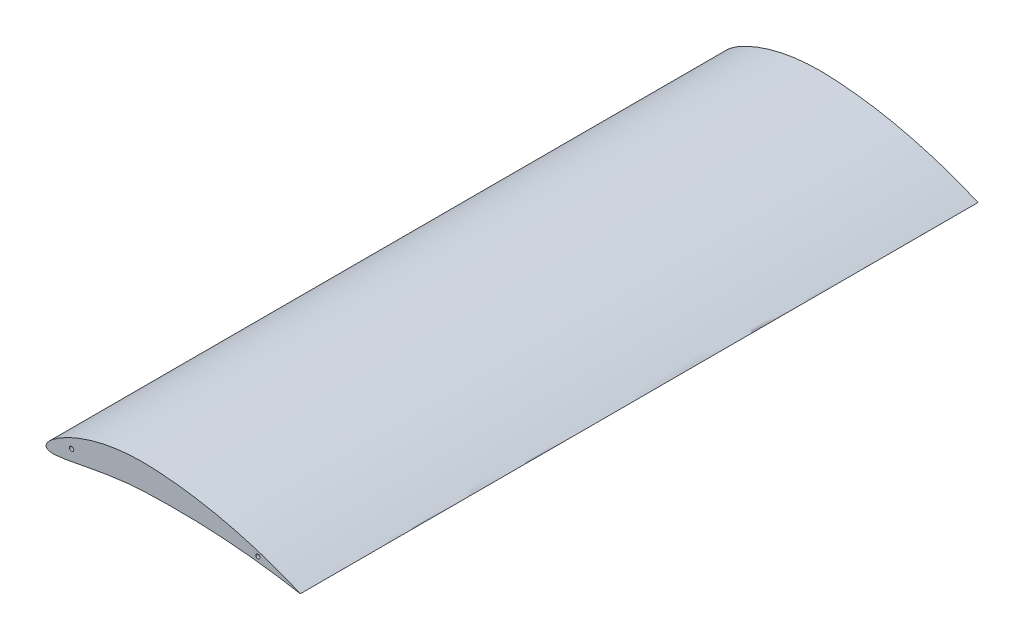
from build123d import *

# Parameters (mm, degrees)
BOSS_EXTRUDE2_DEPTH = 1016
CUT_EXTRUDE1_REACH  = 1088.374
SKETCH5_R           = 3.175


with BuildPart() as part:
    # Sketch4 → Boss-Extrude2 (new body)
    with BuildSketch(Plane.XY):
        with BuildLine():
            add(Edge.make_bspline(
                [(381, 0), (381.004340223, 0.014559136), (380.216291818, 0.314097272), (379.424259056, 0.691712666), (377.451392079, 1.512443051), (375.004021751, 2.55521243), (371.747681331, 3.909218433), (367.832953741, 5.515825662), (363.219866254, 7.370272528), (357.941610365, 9.445214156), (352.008426614, 11.71512786), (345.442389475, 14.153716544), (338.264504332, 16.730909939), (330.499300481, 19.416584386), (322.173268116, 22.177832069), (313.316034267, 24.984272385), (303.958792035, 27.802657499), (294.135347777, 30.601483553), (283.881638744, 33.348947803), (273.236002263, 36.01488088), (262.238478973, 38.569150181), (250.931358845, 40.985002012), (239.358378299, 43.235563653), (227.565235358, 45.297232781), (215.599176704, 47.148241092), (203.508721756, 48.769302988), (191.343459712, 50.142958737), (179.154308517, 51.258264041), (166.992437607, 52.098951361), (154.817089948, 52.681581172), (142.649198528, 52.923625293), (130.544330171, 52.613369472), (118.659752326, 51.815192048), (107.079632604, 50.540845771), (95.862969313, 48.827338278), (85.066049511, 46.711937307), (74.74196753, 44.241190273), (64.940421257, 41.463591704), (55.707246927, 38.432407637), (47.08276621, 35.206007328), (39.104732532, 31.839239065), (31.804252589, 28.39201527), (25.208712938, 24.920908468), (19.341244508, 21.48013989), (14.218572237, 18.123997829), (9.854866374, 14.898921963), (6.258244753, 11.848101214), (3.431621912, 9.007606306), (1.370162702, 6.402198375), (0.066554964, 4.039427406), (-0.477618022, 1.882099765), (-0.14124862, -0.063670718), (1.088542505, -1.60290997), (3.038677042, -2.639545413), (5.621641567, -3.279632982), (8.857746084, -3.572833699), (12.744498924, -3.543053965), (17.269823476, -3.210482476), (22.413132873, -2.599107229), (28.149999783, -1.737056029), (34.453466711, -0.655314819), (41.295181263, 0.610623167), (48.645767883, 2.024525573), (56.475575209, 3.547396025), (64.754537183, 5.13996147), (73.45343051, 6.760436469), (82.54274046, 8.368700263), (91.99372039, 9.923490047), (101.77814458, 11.384728591), (111.868113075, 12.712769639), (122.235763166, 13.873050614), (132.853418671, 14.824922348), (143.716269304, 15.552634633), (154.888235101, 15.976635076), (166.325125804, 16.270984364), (177.963967638, 16.488101143), (189.66968811, 16.594082097), (201.398985443, 16.586148304), (213.108545059, 16.457091424), (224.754010788, 16.204423272), (236.290742625, 15.82723725), (247.673894256, 15.32943698), (258.858235895, 14.716779907), (269.799118121, 13.996864774), (280.451828215, 13.180980989), (290.772868863, 12.28283574), (300.71879428, 11.315783145), (310.247943961, 10.297235175), (319.319352665, 9.24392293), (327.894020206, 8.174529855), (335.934223047, 7.106388727), (343.404721783, 6.058636161), (350.271775357, 5.04893489), (356.504977572, 4.094550785), (362.073616574, 3.210871032), (366.958416735, 2.412822449), (371.118257334, 1.717303927), (374.585771998, 1.121291449), (377.204545554, 0.675636967), (379.303632879, 0.286467581), (380.172779897, 0.168634274), (380.995658166, -0.014564542), (381, 0)],
                knots=[0, 0, 0, 0, 0.000500326, 0.001999908, 0.004491016, 0.007962981, 0.012400212, 0.017782637, 0.024086033, 0.031283105, 0.039342427, 0.048228584, 0.05790426, 0.068327959, 0.07945652, 0.091243042, 0.103640126, 0.116597604, 0.130063469, 0.14398459, 0.158306115, 0.172972351, 0.18792732, 0.203113116, 0.2184717, 0.233944808, 0.249473445, 0.264998855, 0.280462153, 0.295803845, 0.311323629, 0.326706508, 0.341810405, 0.356582637, 0.370971506, 0.384923777, 0.398386753, 0.411306988, 0.423632654, 0.435311865, 0.446295011, 0.456534872, 0.465987533, 0.47461304, 0.482377355, 0.489253053, 0.495223641, 0.50028594, 0.504461055, 0.507811561, 0.510480594, 0.512762222, 0.515043424, 0.517702037, 0.521013381, 0.525103948, 0.530021122, 0.535771893, 0.542341397, 0.549702684, 0.557818571, 0.566648243, 0.576147104, 0.58626814, 0.596964793, 0.60818991, 0.61989864, 0.632046653, 0.644592154, 0.657497245, 0.670724393, 0.684239663, 0.698010813, 0.712098303, 0.726728066, 0.74149363, 0.756341333, 0.771219325, 0.786072643, 0.800847937, 0.815489998, 0.829943038, 0.844152554, 0.858061386, 0.871615338, 0.88475832, 0.897436299, 0.90959464, 0.921181699, 0.932145359, 0.942436617, 0.952008463, 0.960816148, 0.968817229, 0.975973665, 0.982250118, 0.987615556, 0.992043304, 0.995510912, 0.998000498, 0.999499488, 1, 1, 1, 1], degree=3))
        make_face()
    extrude(amount=BOSS_EXTRUDE2_DEPTH)

    # Sketch5 → Cut-Extrude1 (cut, up to next)
    with BuildSketch(Plane(origin=(0, 0, 0), x_dir=(-1, 0, 0), z_dir=(0, 0, -1)), mode=Mode.PRIVATE) as cut_extrude1_sk1:
        with Locations((-37.939753977, 16.58553175)):
            Circle(SKETCH5_R)
    cut_extrude1_tool1 = extrude(cut_extrude1_sk1.sketch, amount=-CUT_EXTRUDE1_REACH, mode=Mode.PRIVATE) & part.part
    # Sketch5 → Cut-Extrude1 (cut, up to next)
    with BuildSketch(Plane(origin=(0, 0, 0), x_dir=(-1, 0, 0), z_dir=(0, 0, -1)), mode=Mode.PRIVATE) as cut_extrude1_sk2:
        with Locations((-317.339753977, 16.58553175)):
            Circle(SKETCH5_R)
    cut_extrude1_tool2 = extrude(cut_extrude1_sk2.sketch, amount=-CUT_EXTRUDE1_REACH, mode=Mode.PRIVATE) & part.part
    add(cut_extrude1_tool1.solids().sort_by_distance((37.939754, 16.585532, 0))[0], mode=Mode.SUBTRACT)
    add(cut_extrude1_tool2.solids().sort_by_distance((317.339754, 16.585532, 0))[0], mode=Mode.SUBTRACT)


solid = part.part
